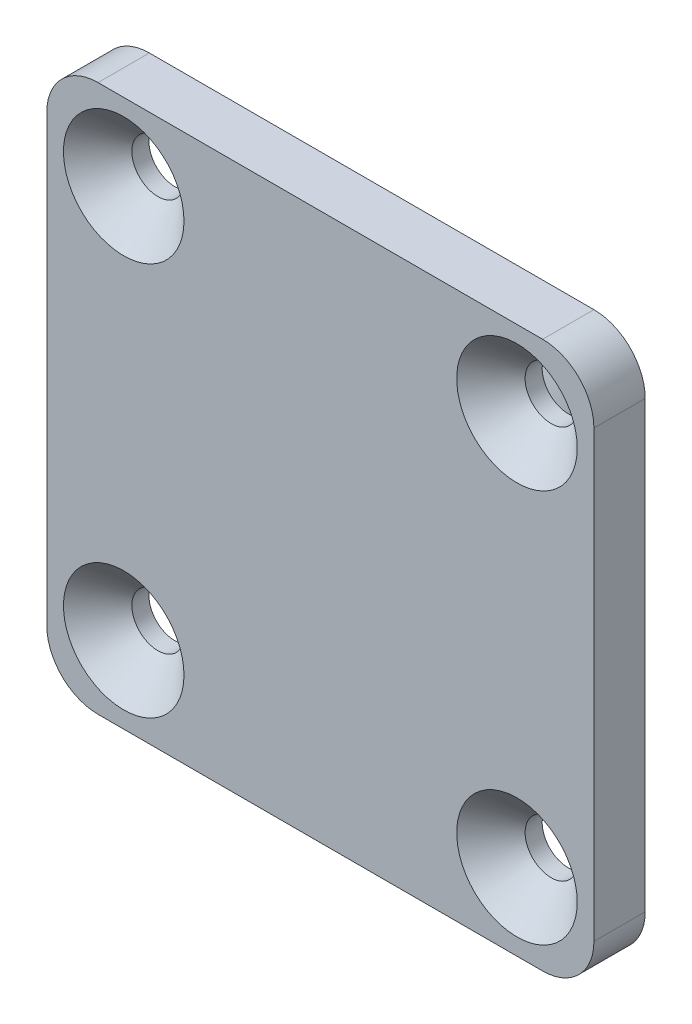
from build123d import *

# Parameters (mm, degrees)
SKETCH_1_R      = 1.525
EXTRUDE_1_DEPTH = 3
SKETCH_2_R      = 10
SKETCH_2_R_2    = 7
EXTRUDE_2_DEPTH = 5.1
CHAMFER_1_SIZE  = 2


with BuildPart() as part:
    # Эскиз1 → Бобышка-Вытянуть1 (new body)
    with BuildSketch(Plane.XY):
        with BuildLine():
            Line((13, 16), (-13, 16))
            ThreePointArc((-13, 16), (-15.121320344, 15.121320344), (-16, 13))
            Line((-16, 13), (-16, -13))
            ThreePointArc((-16, -13), (-15.121320344, -15.121320344), (-13, -16))
            Line((-13, -16), (13, -16))
            ThreePointArc((13, -16), (15.121320344, -15.121320344), (16, -13))
            Line((16, -13), (16, 13))
            ThreePointArc((16, 13), (15.121320344, 15.121320344), (13, 16))
        make_face()
        with Locations((-11.5, -11.5)):
            Circle(SKETCH_1_R, mode=Mode.SUBTRACT)
        with Locations((-11.5, 11.5)):
            Circle(SKETCH_1_R, mode=Mode.SUBTRACT)
        with Locations((11.5, -11.5)):
            Circle(SKETCH_1_R, mode=Mode.SUBTRACT)
        with Locations((11.5, 11.5)):
            Circle(SKETCH_1_R, mode=Mode.SUBTRACT)
    extrude(amount=EXTRUDE_1_DEPTH)

    # Эскиз2 → Бобышка-Вытянуть2 (add)
    with BuildSketch(Plane(origin=(0, 0, 0), x_dir=(-1, 0, 0), z_dir=(0, 0, -1))):
        with Locations(Location((0, 0, 0), (0, 0, 180))):
            Circle(SKETCH_2_R)
        Circle(SKETCH_2_R_2, mode=Mode.SUBTRACT)
    extrude(amount=EXTRUDE_2_DEPTH)

    # Фаска1
    chamfer_1_edges = [part.edges().sort_by_distance(p)[0] for p in [
        (-13.025, -11.5, 3),
        (9.975, -11.5, 3),
        (9.975, 11.5, 3),
        (-13.025, 11.5, 3),
    ]]
    chamfer(chamfer_1_edges, length=CHAMFER_1_SIZE)


solid = part.part
